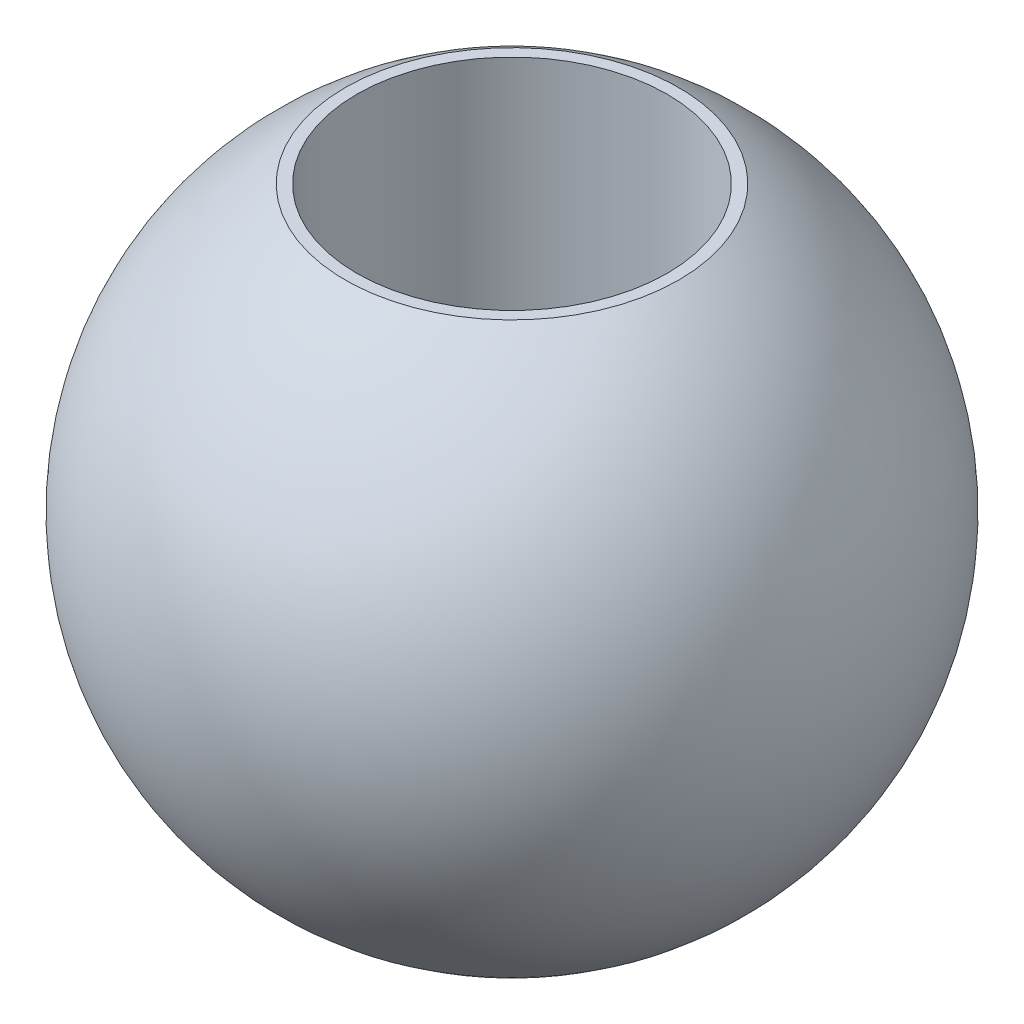
from build123d import *

# Parameters (mm, degrees)
CUT_EXTRUDE3_DEPTH      = 10
CUT_EXTRUDE3_DEPTH_BACK = 10
SKETCH6_R               = 3.2
CUT_EXTRUDE5_DEPTH      = 11.721374412


with BuildPart() as part:
    # Sketch1 → Revolve1 (revolve)
    with BuildSketch(Plane.XY):
        with BuildLine():
            Line((-3.245502242, 5.970302284), (3.245502242, -5.970302284))
            ThreePointArc((3.245502242, -5.970302284), (5.970302284, 3.245502242), (-3.245502242, 5.970302284))
        make_face()
    revolve(axis=Axis((-3.245502242, 5.970302284, 0), (0.477601103601981, -0.8785767956406371, 0)))

    # Sketch4 → Cut-Extrude3 (cut, two sides: drawn at the far end of the back side and taken through both)
    with BuildSketch(Plane.XY.offset(-CUT_EXTRUDE3_DEPTH_BACK)):
        Polygon((8.159968685, 8.571644262), (-8.716743866, 8.555246622), (-8.716743866, 5.861385957), (8.159968685, 5.861385957), align=None)
        Polygon((0, -8.396596185), (-8.716743866, -8.134988455), (-8.716743866, -5.859988455), (8.159968685, -5.859988455), (8.159968685, -8.396596185), align=None)
    extrude(amount=CUT_EXTRUDE3_DEPTH + CUT_EXTRUDE3_DEPTH_BACK, mode=Mode.SUBTRACT)

    # Sketch6 → Cut-Extrude5 (cut)
    with BuildSketch(Plane(origin=(0, 5.861385957, 0), x_dir=(1, 0, 0), z_dir=(0, 1, 0))):
        with Locations(Location((0, 0, 0), (0, 0, 270))):
            Circle(SKETCH6_R)
    extrude(amount=-CUT_EXTRUDE5_DEPTH, mode=Mode.SUBTRACT)


with BuildPart() as body_2:
    # Sketch7 → Revolve2 (revolve)
    with BuildSketch(Plane.XY):
        with BuildLine():
            Line((0.05, 0), (0.077844983, 0))
            ThreePointArc((0.077844983, 0), (0, -0.077844983), (-0.077844983, 0))
            Line((-0.077844983, 0), (-0.05, 0))
            ThreePointArc((-0.05, 0), (0, -0.05), (0.05, 0))
        make_face()
    revolve(axis=Axis((0, 0, 0), (1, 0, 0)))


solid = Compound([part.part, body_2.part])
